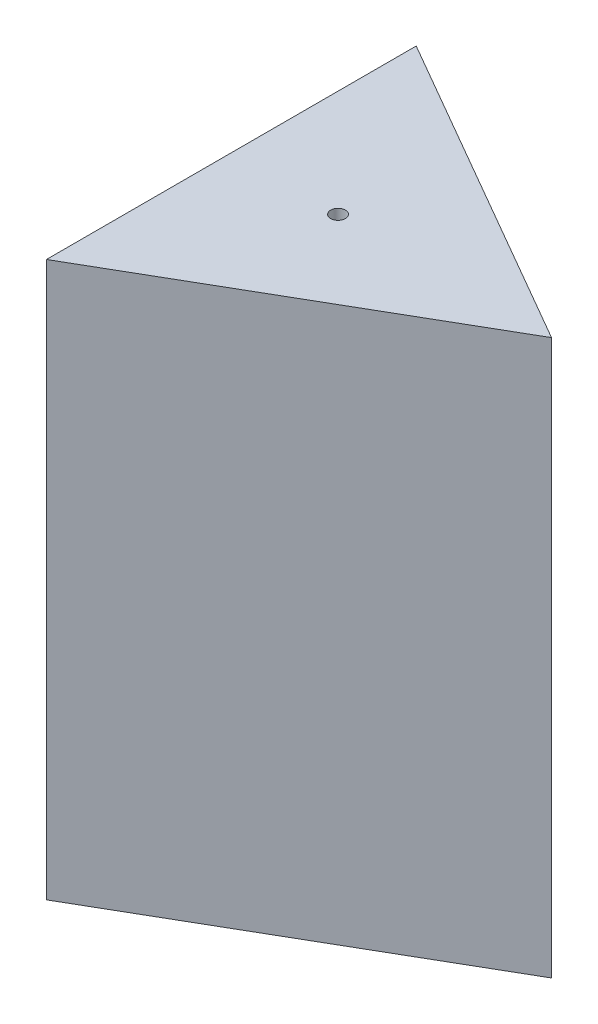
from build123d import *

# Parameters (mm, degrees)
BOSS_EXTRUDE2_DEPTH = 300
SKETCH3_R           = 4
CUT_EXTRUDE2_DEPTH  = 300


with BuildPart() as part:
    # Sketch1 → Boss-Extrude2 (new body)
    with BuildSketch(Plane(origin=(0, 0, 0), x_dir=(1, 0, 0), z_dir=(0, 1, 0))):
        Polygon((115.470053838, 0), (-57.735026919, 100), (-57.735026919, -100), align=None)
    extrude(amount=BOSS_EXTRUDE2_DEPTH)

    # Sketch3 → Cut-Extrude2 (cut)
    with BuildSketch(Plane.XZ):
        with Locations(Location((0, 0, 0), (0, 0, 270))):
            Circle(SKETCH3_R)
    extrude(amount=-CUT_EXTRUDE2_DEPTH, mode=Mode.SUBTRACT)


solid = part.part
